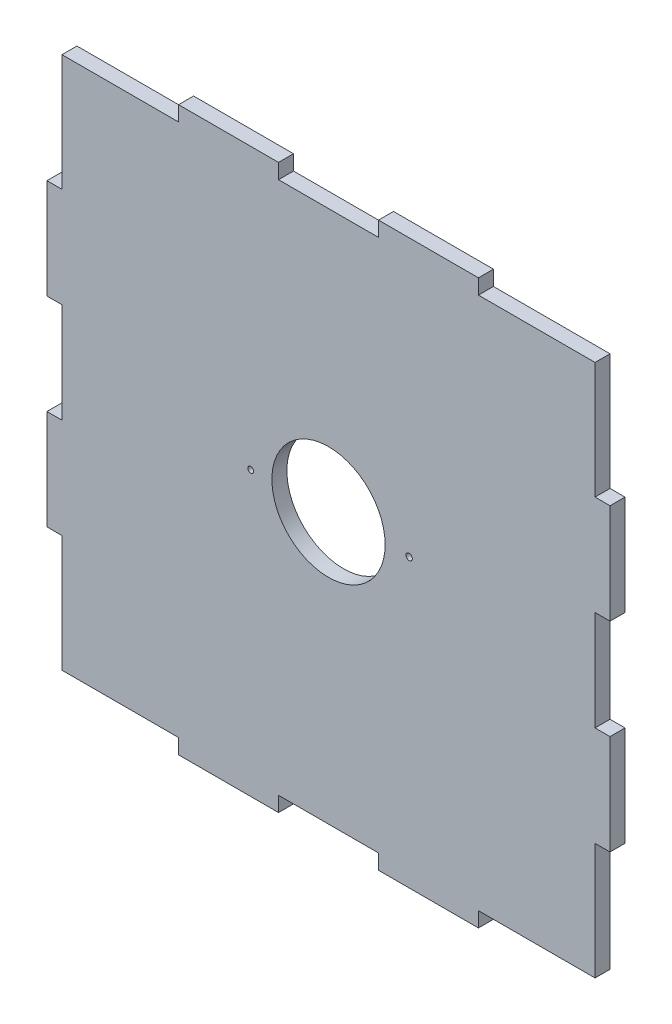
from build123d import *

# Parameters (mm, degrees)
BOSS_EXTRUDE1_DEPTH = 9
SKETCH3_R           = 34
CUT_EXTRUDE1_DEPTH  = 10
SKETCH4_R           = 1.908180832
SKETCH4_R_2         = 1.75
CUT_EXTRUDE2_DEPTH  = 276.178116638


with BuildPart() as part:
    # Sketch2 → Boss-Extrude1 (new body)
    with BuildSketch(Plane.XY):
        Polygon((110.844662491, -190), (110.844662491, -199), (50.844662491, -199), (50.844662491, -190), (-9.155337509, -190), (-9.155337509, -199), (-69.155337509, -199), (-69.155337509, -190), (-139.155337509, -190), (-139.155337509, -120), (-148.155337509, -120), (-148.155337509, -60), (-139.155337509, -60), (-139.155337509, 0), (-148.155337509, 0), (-148.155337509, 60), (-139.155337509, 60), (-139.155337509, 130), (-69.155337509, 130), (-69.155337509, 139), (-9.155337509, 139), (-9.155337509, 130), (50.844662491, 130), (50.844662491, 139), (110.844662491, 139), (110.844662491, 130), (180.844662491, 130), (180.844662491, 60), (189.844662491, 60), (189.844662491, 0), (180.844662491, 0), (180.844662491, -60), (189.844662491, -60), (189.844662491, -120), (180.844662491, -120), (180.844662491, -190), align=None)
    extrude(amount=BOSS_EXTRUDE1_DEPTH)

    # Sketch3 → Cut-Extrude1 (cut)
    with BuildSketch(Plane.XY.offset(9)):
        with Locations((20.844662491, -27.75)):
            Circle(SKETCH3_R)
    extrude(amount=-CUT_EXTRUDE1_DEPTH, mode=Mode.SUBTRACT)

    # Sketch4 → Cut-Extrude2 (cut, through all)
    with BuildSketch(Plane.XY.offset(9)):
        with Locations((69.247698425, -26.871593426)):
            Circle(SKETCH4_R)
        with Locations((-25.819672208, -29.158773424)):
            Circle(SKETCH4_R_2)
    extrude(amount=-CUT_EXTRUDE2_DEPTH, mode=Mode.SUBTRACT)


solid = part.part
